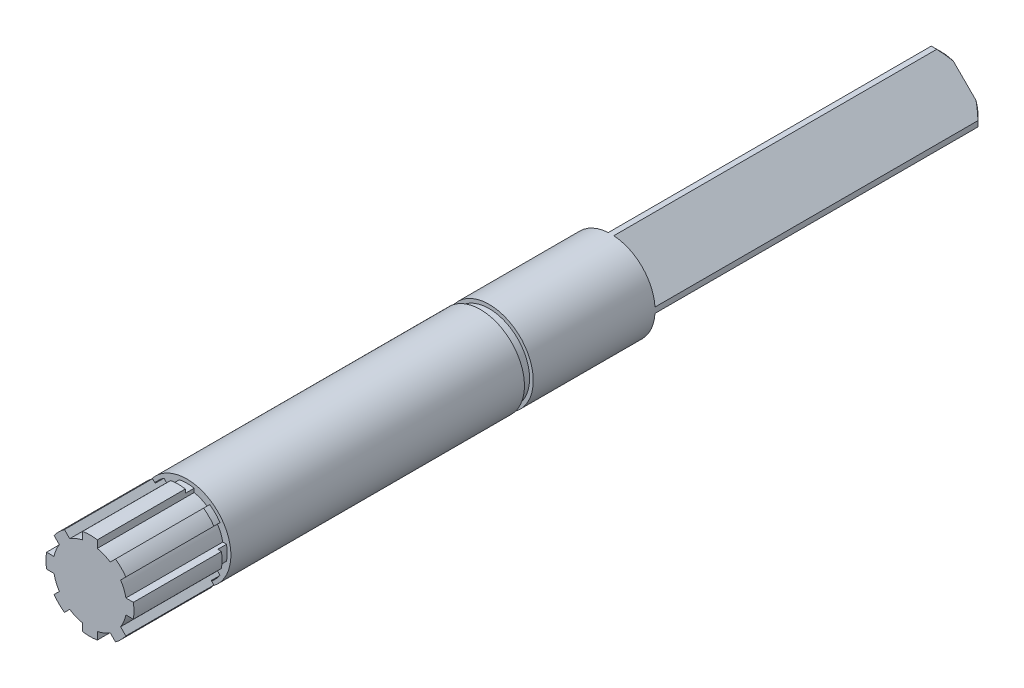
from build123d import *

# Parameters (mm, degrees)
SKETCH_1_R          = 6
EXTRUDE_1_DEPTH     = 116
CUT_EXTRUDE_START   = -13.2
SKETCH_2_OUTSIDE_W  = 37.446
SKETCH_2_OUTSIDE_H  = 37.446
SKETCH_2_OUTSIDE_R  = 5.5
CUT_EXTRUDE_1_DEPTH = 1.2
CUT_EXTRUDE_START_2 = -40
SKETCH_3_OUTSIDE_W  = 37.446
SKETCH_3_OUTSIDE_H  = 37.446
SKETCH_3_OUTSIDE_R  = 5.5
CUT_EXTRUDE_2_DEPTH = 1.2
CUT_EXTRUDE_3_DEPTH = 13.2
CHAMFER_1_SIZE      = 1
SKETCH_5_OUTSIDE_W  = 37.446
SKETCH_5_OUTSIDE_H  = 37.446
CUT_EXTRUDE_4_DEPTH = 45


with BuildPart() as part:
    # 草图1 → 凸台-拉伸1 (new body)
    with BuildSketch(Plane.XY):
        with Locations(Location((0, 0, 0), (0, 0, 180))):
            Circle(SKETCH_1_R)
    extrude(amount=EXTRUDE_1_DEPTH)

    # 草图2 outside → 切除-拉伸1 (cut)
    with BuildSketch(Plane.XY.offset(116).offset(CUT_EXTRUDE_START)):
        Rectangle(SKETCH_2_OUTSIDE_W, SKETCH_2_OUTSIDE_H)
        Circle(SKETCH_2_OUTSIDE_R, mode=Mode.SUBTRACT)
    extrude(amount=CUT_EXTRUDE_1_DEPTH, mode=Mode.SUBTRACT)

    # 草图3 outside → 切除-拉伸2 (cut)
    with BuildSketch(Plane.XY.offset(102.8).offset(CUT_EXTRUDE_START_2)):
        Rectangle(SKETCH_3_OUTSIDE_W, SKETCH_3_OUTSIDE_H)
        Circle(SKETCH_3_OUTSIDE_R, mode=Mode.SUBTRACT)
    extrude(amount=-CUT_EXTRUDE_2_DEPTH, mode=Mode.SUBTRACT)

    # 草图4 → 切除-拉伸3 (cut)
    with BuildSketch(Plane.XY.offset(116).offset(CUT_EXTRUDE_START)):
        with BuildLine():
            Line((-1, 4.898979486), (-1, 5.916079783))
            ThreePointArc((-1, 5.916079783), (-2.296100594, 5.543277195), (-3.476193351, 4.890406914))
            Line((-3.476193351, 4.890406914), (-2.756994834, 4.171208396))
            ThreePointArc((-2.756994834, 4.171208396), (-1.913417162, 4.619397663), (-1, 4.898979486))
        make_face()
        with BuildLine():
            Line((1, 4.898979486), (1, 5.916079783))
            ThreePointArc((1, 5.916079783), (2.296100594, 5.543277195), (3.476193351, 4.890406914))
            Line((3.476193351, 4.890406914), (2.756994834, 4.171208396))
            ThreePointArc((2.756994834, 4.171208396), (1.913417162, 4.619397663), (1, 4.898979486))
        make_face()
        with BuildLine():
            Line((4.171208396, 2.756994834), (4.890406914, 3.476193351))
            ThreePointArc((4.890406914, 3.476193351), (5.543277195, 2.296100594), (5.916079783, 1))
            Line((5.916079783, 1), (4.898979486, 1))
            ThreePointArc((4.898979486, 1), (4.619397663, 1.913417162), (4.171208396, 2.756994834))
        make_face()
        with BuildLine():
            Line((4.898979486, -1), (5.916079783, -1))
            ThreePointArc((5.916079783, -1), (5.543277195, -2.296100594), (4.890406914, -3.476193351))
            Line((4.890406914, -3.476193351), (4.171208396, -2.756994834))
            ThreePointArc((4.171208396, -2.756994834), (4.619397663, -1.913417162), (4.898979486, -1))
        make_face()
        with BuildLine():
            Line((2.756994834, -4.171208396), (3.476193351, -4.890406914))
            ThreePointArc((3.476193351, -4.890406914), (2.296100594, -5.543277195), (1, -5.916079783))
            Line((1, -5.916079783), (1, -4.898979486))
            ThreePointArc((1, -4.898979486), (1.913417162, -4.619397663), (2.756994834, -4.171208396))
        make_face()
        with BuildLine():
            Line((-1, -4.898979486), (-1, -5.916079783))
            ThreePointArc((-1, -5.916079783), (-2.296100594, -5.543277195), (-3.476193351, -4.890406914))
            Line((-3.476193351, -4.890406914), (-2.756994834, -4.171208396))
            ThreePointArc((-2.756994834, -4.171208396), (-1.913417162, -4.619397663), (-1, -4.898979486))
        make_face()
        with BuildLine():
            Line((-4.171208396, -2.756994834), (-4.890406914, -3.476193351))
            ThreePointArc((-4.890406914, -3.476193351), (-5.543277195, -2.296100594), (-5.916079783, -1))
            Line((-5.916079783, -1), (-4.898979486, -1))
            ThreePointArc((-4.898979486, -1), (-4.619397663, -1.913417162), (-4.171208396, -2.756994834))
        make_face()
        with BuildLine():
            Line((-4.898979486, 1), (-5.916079783, 1))
            ThreePointArc((-5.916079783, 1), (-5.543277195, 2.296100594), (-4.890406914, 3.476193351))
            Line((-4.890406914, 3.476193351), (-4.171208396, 2.756994834))
            ThreePointArc((-4.171208396, 2.756994834), (-4.619397663, 1.913417162), (-4.898979486, 1))
        make_face()
    extrude(amount=CUT_EXTRUDE_3_DEPTH, mode=Mode.SUBTRACT)

    # 倒角1
    chamfer_1_edges = [part.edges().sort_by_distance(p)[0] for p in [
        (6, 0, 0),
    ]]
    chamfer(chamfer_1_edges, length=CHAMFER_1_SIZE)

    # 草图5 outside → 切除-拉伸4 (cut)
    with BuildSketch(Plane(origin=(0, 0, 0), x_dir=(-1, 0, 0), z_dir=(0, 0, -1))):
        Rectangle(SKETCH_5_OUTSIDE_W, SKETCH_5_OUTSIDE_H)
        Polygon((0, -6.363961031), (6.363961031, 0), (0, 6.363961031), (-6.363961031, 0), align=None, mode=Mode.SUBTRACT)
    extrude(amount=-CUT_EXTRUDE_4_DEPTH, mode=Mode.SUBTRACT)


solid = part.part
